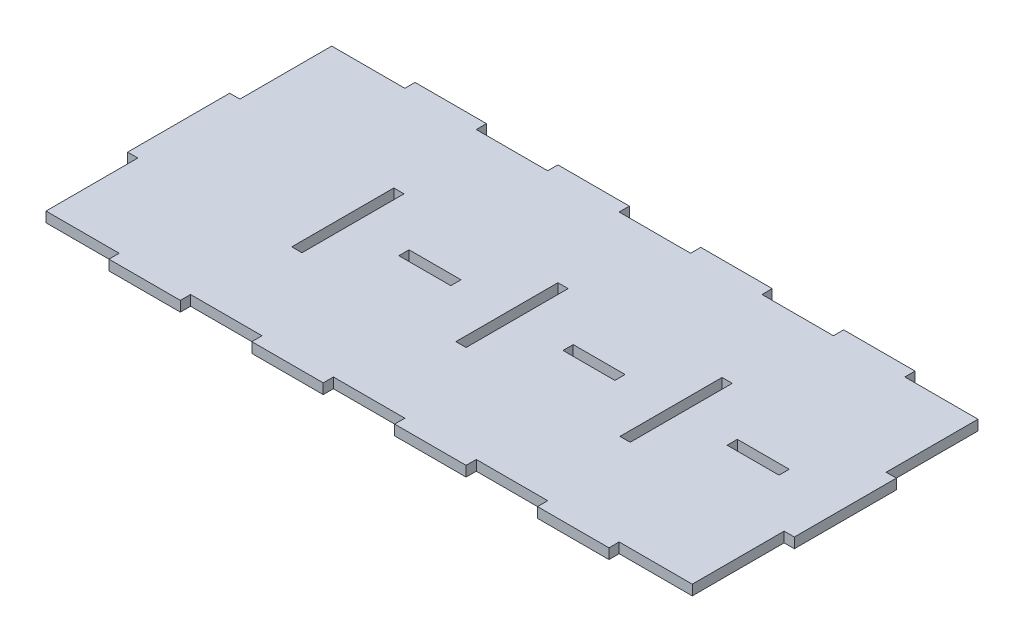
from build123d import *

# Parameters (mm, degrees)
SKETCH1_W           = 3
SKETCH1_H           = 30
SKETCH1_W_2         = 15.25
SKETCH1_H_2         = 3
BOSS_EXTRUDE1_DEPTH = 3


with BuildPart() as part:
    # Sketch1 → Boss-Extrude1 (new body)
    with BuildSketch(Plane(origin=(0, 0, 0), x_dir=(1, 0, 0), z_dir=(0, 1, 0))):
        Polygon((-95, 15), (-98, 15), (-98, -15), (-95, -15), (-95, -42), (-73.5, -42), (-73.5, -45), (-52.5, -45), (-52.5, -42), (-31.5, -42), (-31.5, -45), (-10.5, -45), (-10.5, -42), (10.5, -42), (10.5, -45), (31.5, -45), (31.5, -42), (52.5, -42), (52.5, -45), (73.5, -45), (73.5, -42), (95, -42), (95, -15), (98, -15), (98, 15), (95, 15), (95, 42), (73.5, 42), (73.5, 45), (52.5, 45), (52.5, 42), (31.5, 42), (31.5, 45), (10.5, 45), (10.5, 42), (-10.5, 42), (-10.5, 45), (-31.5, 45), (-31.5, 42), (-52.5, 42), (-52.5, 45), (-73.5, 45), (-73.5, 42), (-95, 42), align=None)
        Rectangle(SKETCH1_W, SKETCH1_H, mode=Mode.SUBTRACT)
        with Locations((48.25, 0)):
            Rectangle(SKETCH1_W, SKETCH1_H, mode=Mode.SUBTRACT)
        with Locations((72.375, 0)):
            Rectangle(SKETCH1_W_2, SKETCH1_H_2, mode=Mode.SUBTRACT)
        with Locations((-48.25, 0)):
            Rectangle(SKETCH1_W, SKETCH1_H, mode=Mode.SUBTRACT)
        with Locations((-24.125, 0)):
            Rectangle(SKETCH1_W_2, SKETCH1_H_2, mode=Mode.SUBTRACT)
        with Locations((24.125, 0)):
            Rectangle(SKETCH1_W_2, SKETCH1_H_2, mode=Mode.SUBTRACT)
    extrude(amount=BOSS_EXTRUDE1_DEPTH)


solid = part.part
